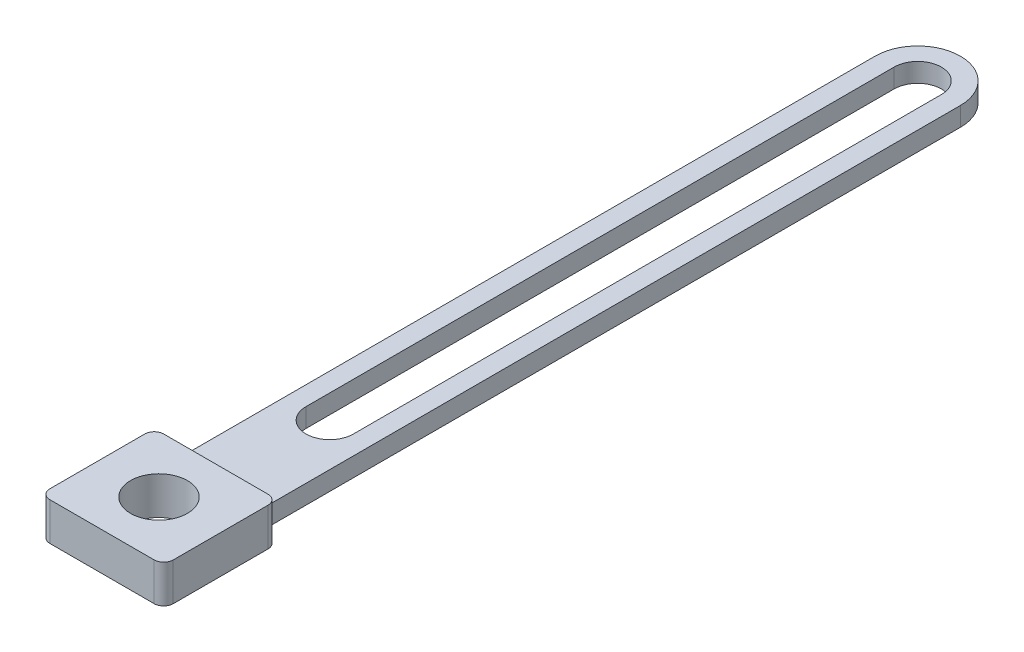
from build123d import *

# Parameters (mm, degrees)
BOSS_EXTRUDE1_DEPTH = 1
CUT_EXTRUDE1_DEPTH  = 2
SKETCH3_W           = 13
SKETCH3_H           = 12
BOSS_EXTRUDE2_DEPTH = 2
FILLET1_R           = 1
SKETCH4_R           = 3
CUT_EXTRUDE2_DEPTH  = 4


with BuildPart() as part:
    # Sketch1 → Boss-Extrude1 (new, symmetric)
    with BuildSketch(Plane(origin=(0, 0, 0), x_dir=(1, 0, 0), z_dir=(0, 1, 0))):
        with BuildLine():
            Line((-7.381578947, 14.960526316), (-7.381578947, -65.039473684))
            ThreePointArc((-7.381578947, -65.039473684), (-2.881578947, -69.539473684), (1.618421053, -65.039473684))
            Line((1.618421053, -65.039473684), (1.618421053, 14.960526316))
            ThreePointArc((1.618421053, 14.960526316), (-2.881578947, 19.460526316), (-7.381578947, 14.960526316))
        make_face()
    extrude(amount=BOSS_EXTRUDE1_DEPTH, both=True)

    # Sketch2 → Cut-Extrude1 (cut)
    with BuildSketch(Plane(origin=(0, 1, 0), x_dir=(1, 0, 0), z_dir=(0, 1, 0))):
        with BuildLine():
            Line((-5.381578947, 14.960526316), (-5.381578947, -47.039473684))
            ThreePointArc((-5.381578947, -47.039473684), (-2.881578947, -49.539473684), (-0.381578947, -47.039473684))
            Line((-0.381578947, -47.039473684), (-0.381578947, 14.960526316))
            ThreePointArc((-0.381578947, 14.960526316), (-2.881578947, 17.460526316), (-5.381578947, 14.960526316))
        make_face()
    extrude(amount=-CUT_EXTRUDE1_DEPTH, mode=Mode.SUBTRACT)

    # Sketch3 → Boss-Extrude2 (add, symmetric)
    with BuildSketch(Plane(origin=(0, 1, 0), x_dir=(1, 0, 0), z_dir=(0, 1, 0))):
        with Locations((-2.881578947, -65.039473684)):
            Rectangle(SKETCH3_W, SKETCH3_H)
    extrude(amount=BOSS_EXTRUDE2_DEPTH, both=True)

    # Fillet1
    fillet1_edges = [part.edges().sort_by_distance(p)[0] for p in [
        (3.618421053, 1, 59.039473684),
        (-9.381578947, 1, 59.039473684),
        (-9.381578947, 1, 71.039473684),
        (3.618421053, 1, 71.039473684),
    ]]
    fillet(fillet1_edges, radius=FILLET1_R)

    # Sketch4 → Cut-Extrude2 (cut)
    with BuildSketch(Plane(origin=(0, 3, 0), x_dir=(1, 0, 0), z_dir=(0, 1, 0))):
        with Locations(Location((-2.881578947, -65.039473684, 0), (0, 0, 270))):
            Circle(SKETCH4_R)
    extrude(amount=-CUT_EXTRUDE2_DEPTH, mode=Mode.SUBTRACT)


solid = part.part
